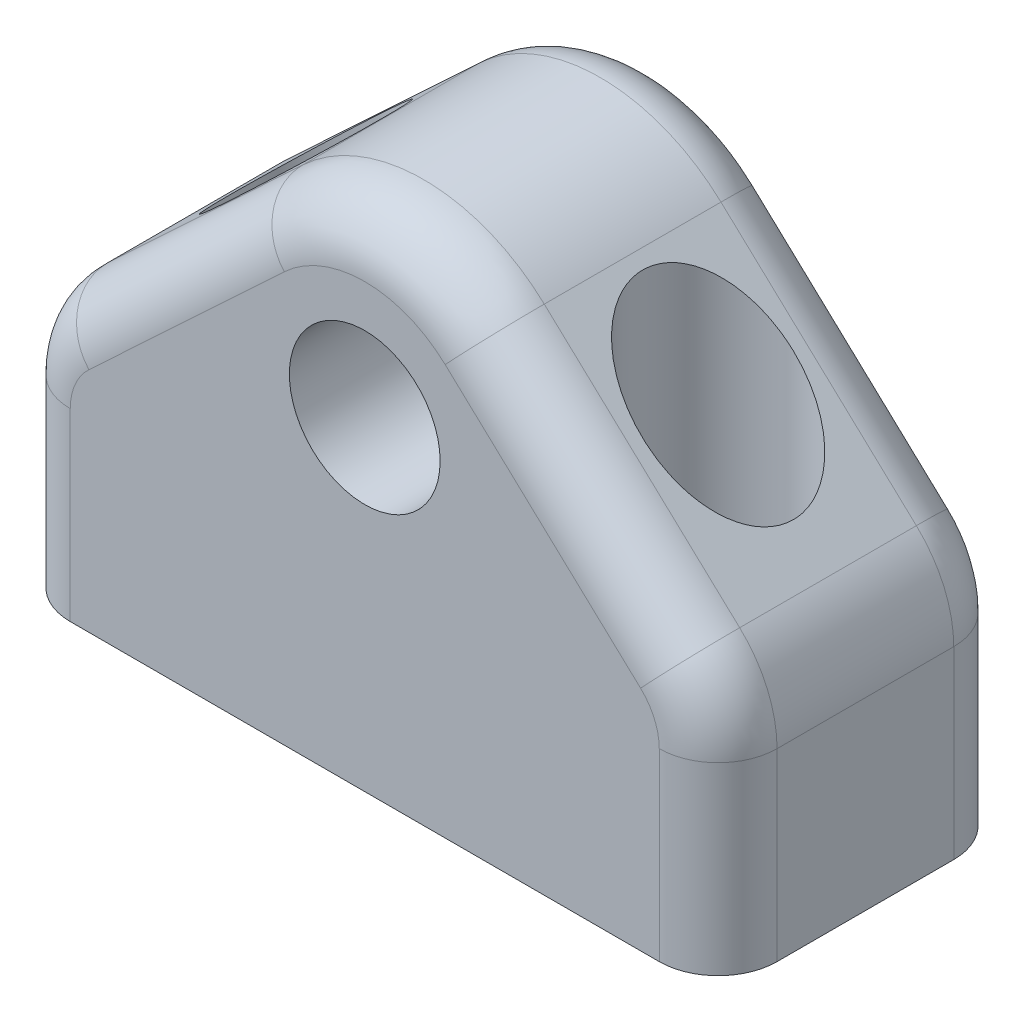
from build123d import *

# Parameters (mm, degrees)
SKETCH1_R           = 2.032
BOSS_EXTRUDE1_DEPTH = 7.9375
SKETCH2_R           = 2.032
CUT_EXTRUDE1_DEPTH  = 25.6574065
FILLET1_R           = 1.5875


with BuildPart() as part:
    # Sketch1 → Boss-Extrude1 (new body)
    with BuildSketch(Plane.XY):
        with BuildLine():
            Line((0, 0), (0, 4.971229117))
            ThreePointArc((0, 4.971229117), (0.262744783, 6.235900833), (1.007492629, 7.291258599))
            Line((1.007492629, 7.291258599), (6.273738944, 12.211294223))
            ThreePointArc((6.273738944, 12.211294223), (9.525, 13.49375), (12.776261056, 12.211294223))
            Line((12.776261056, 12.211294223), (18.042507371, 7.291258599))
            ThreePointArc((18.042507371, 7.291258599), (18.787255217, 6.235900833), (19.05, 4.971229117))
            Line((19.05, 4.971229117), (19.05, 0))
            Line((19.05, 0), (0, 0))
        make_face()
        with Locations((9.525, 8.73125)):
            Circle(SKETCH1_R, mode=Mode.SUBTRACT)
    extrude(amount=BOSS_EXTRUDE1_DEPTH)

    # Sketch2 → Cut-Extrude1 (cut, through all)
    with BuildSketch(Plane.XZ):
        with Locations(Location((3.96875, 3.96875, 0), (0, 0, 270))):
            Circle(SKETCH2_R)
        with Locations(Location((15.08125, 3.96875, 0), (0, 0, 270))):
            Circle(SKETCH2_R)
    extrude(amount=-CUT_EXTRUDE1_DEPTH, mode=Mode.SUBTRACT)

    # Fillet1
    fillet1_edges = [part.edges().sort_by_distance(p)[0] for p in [
        (15.409384213, 9.751276411, 0),
        (18.787255217, 6.235900833, 0),
        (19.05, 2.485614558, 0),
        (18.787255217, 6.235900833, 7.9375),
        (15.409384213, 9.751276411, 7.9375),
        (9.525, 13.49375, 7.9375),
        (3.640615787, 9.751276411, 7.9375),
        (0.262744783, 6.235900833, 7.9375),
        (0, 2.485614558, 7.9375),
        (0, 2.485614558, 0),
        (19.05, 2.485614558, 7.9375),
        (0.262744783, 6.235900833, 0),
        (3.640615787, 9.751276411, 0),
        (9.525, 13.49375, 0),
    ]]
    fillet(fillet1_edges, radius=FILLET1_R)


solid = part.part
